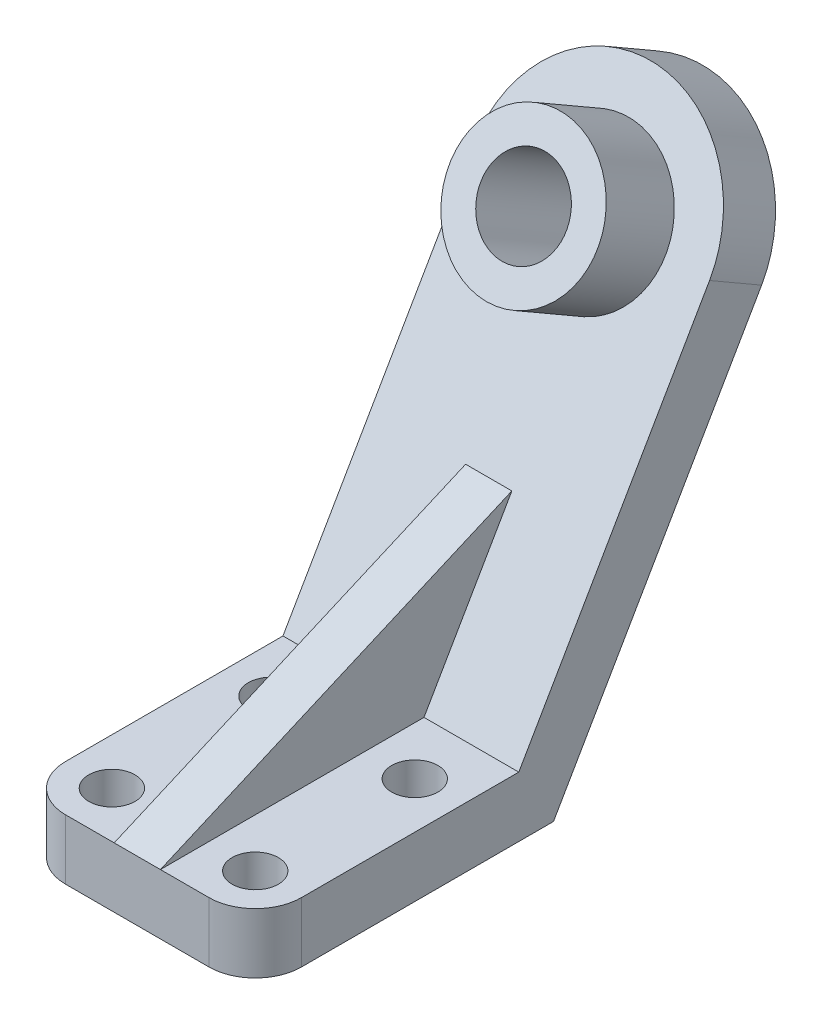
from build123d import *

# Parameters (mm, degrees)
BOSS_EXTRUDE1_DEPTH = 51
CUT_EXTRUDE1_DEPTH  = 102
BOSS_EXTRUDE2_START = -26
SKETCH4_R           = 32
BOSS_EXTRUDE2_DEPTH = 60
SKETCH5_R           = 18.5
CUT_EXTRUDE2_DEPTH  = 316.950756304
BOSS_EXTRUDE3_DEPTH = 10
SKETCH7_R           = 10
CUT_EXTRUDE3_DEPTH  = 313.368418834
FILLET1_R           = 20


with BuildPart() as part:
    # Sketch2 → Boss-Extrude1 (new, symmetric)
    with BuildSketch(Plane(origin=(0, 0, 0), x_dir=(0, 0, -1), z_dir=(1, 0, 0))):
        Polygon((0, 0), (54.31624891, 0), (129, 0), (244.5, 200.051868274), (221.983339502, 213.051868274), (113.988893001, 26), (0, 26), align=None)
    extrude(amount=BOSS_EXTRUDE1_DEPTH, both=True)

    # Sketch3 → Cut-Extrude1 (cut)
    with BuildSketch(Plane(origin=(0, -42.858638544, -74.233339502), x_dir=(1, 0, 0), z_dir=(0, 0.49999999999999784, 0.86602540378444))):
        with BuildLine():
            Line((-51, 295.5), (-51, 244.5))
            ThreePointArc((-51, 244.5), (-36.062445841, 280.562445841), (0, 295.5))
            Line((0, 295.5), (-51, 295.5))
        make_face()
        with BuildLine():
            Line((51, 295.5), (0, 295.5))
            ThreePointArc((0, 295.5), (36.062445841, 280.562445841), (51, 244.5))
            Line((51, 244.5), (51, 295.5))
        make_face()
    extrude(amount=-CUT_EXTRUDE1_DEPTH, mode=Mode.SUBTRACT)

    # Sketch4 → Boss-Extrude2 (add)
    with BuildSketch(Plane(origin=(0, -42.858638544, -74.233339502), x_dir=(1, 0, 0), z_dir=(0, 0.49999999999999784, 0.86602540378444)).offset(BOSS_EXTRUDE2_START)):
        with Locations(Location((0, 244.5, 0), (0, 0, 270))):
            Circle(SKETCH4_R)
    extrude(amount=BOSS_EXTRUDE2_DEPTH)

    # Sketch5 → Cut-Extrude2 (cut, through all)
    with BuildSketch(Plane(origin=(0, -25.858638544, -44.788475772), x_dir=(1, 0, 0), z_dir=(0, 0.49999999999999784, 0.86602540378444))):
        with Locations(Location((0, 244.5, 0), (0, 0, 270))):
            Circle(SKETCH5_R)
    extrude(amount=-CUT_EXTRUDE2_DEPTH, mode=Mode.SUBTRACT)

    # Sketch6 → Boss-Extrude3 (add, symmetric)
    with BuildSketch(Plane(origin=(0, 0, 0), x_dir=(0, 0, -1), z_dir=(1, 0, 0))):
        Polygon((0, 26), (151.988893001, 91.817930688), (113.988893001, 26), align=None)
    extrude(amount=BOSS_EXTRUDE3_DEPTH, both=True)

    # Sketch7 → Cut-Extrude3 (cut, through all)
    with BuildSketch(Plane(origin=(0, 26, 0), x_dir=(1, 0, 0), z_dir=(0, 1, 0))):
        with Locations(Location((31, 20, 0), (0, 0, 270))):
            Circle(SKETCH7_R)
        with Locations(Location((-31, 20, 0), (0, 0, 270))):
            Circle(SKETCH7_R)
        with Locations(Location((-31, 89, 0), (0, 0, 270))):
            Circle(SKETCH7_R)
        with Locations(Location((31, 89, 0), (0, 0, 270))):
            Circle(SKETCH7_R)
    extrude(amount=-CUT_EXTRUDE3_DEPTH, mode=Mode.SUBTRACT)

    # Fillet1
    fillet1_edges = [part.edges().sort_by_distance(p)[0] for p in [
        (51, 13, 0),
        (-51, 13, 0),
    ]]
    fillet(fillet1_edges, radius=FILLET1_R)


solid = part.part
